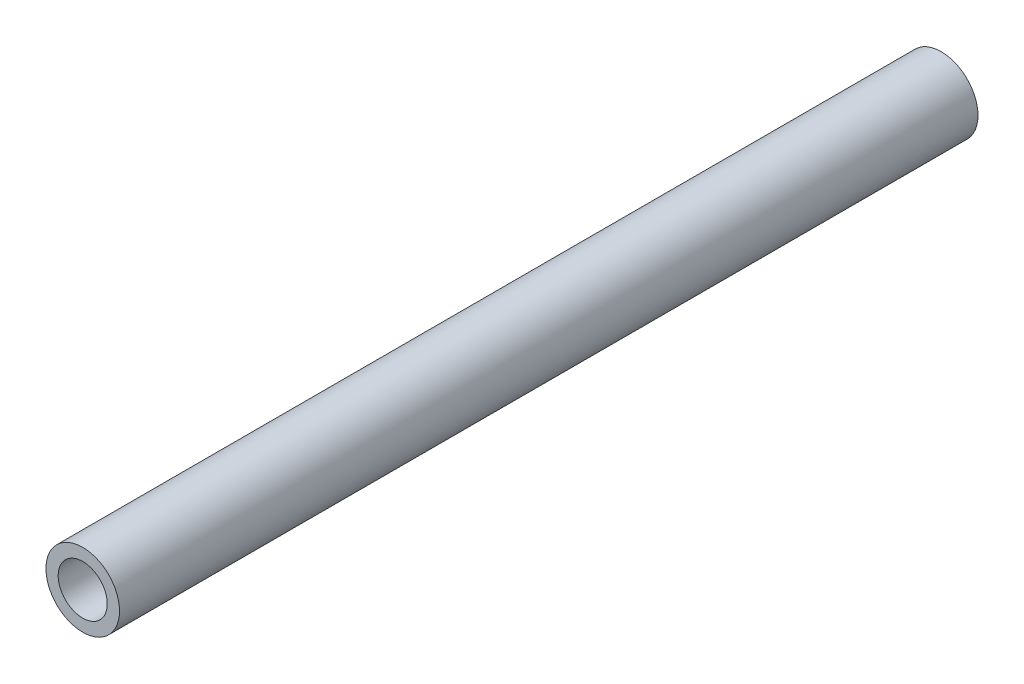
from build123d import *

# Parameters (mm, degrees)
SKETCH1_R           = 3
BOSS_EXTRUDE1_DEPTH = 70
SKETCH2_R           = 2
CUT_EXTRUDE1_DEPTH  = 7
CUT_EXTRUDE2_START  = -7
SKETCH3_R           = 2
CUT_EXTRUDE2_DEPTH  = 7


with BuildPart() as part:
    # Sketch1 → Boss-Extrude1 (new body)
    with BuildSketch(Plane.XY):
        Circle(SKETCH1_R)
    extrude(amount=BOSS_EXTRUDE1_DEPTH)

    # Sketch2 → Cut-Extrude1 (cut)
    with BuildSketch(Plane.XY.offset(70)):
        Circle(SKETCH2_R)
    extrude(amount=-CUT_EXTRUDE1_DEPTH, mode=Mode.SUBTRACT)

    # Sketch3 → Cut-Extrude2 (cut)
    with BuildSketch(Plane(origin=(0, 0, 0), x_dir=(-1, 0, 0), z_dir=(0, 0, -1)).offset(CUT_EXTRUDE2_START)):
        with Locations(Location((0, 0, 0), (0, 0, 180))):
            Circle(SKETCH3_R)
    extrude(amount=CUT_EXTRUDE2_DEPTH, mode=Mode.SUBTRACT)


solid = part.part
